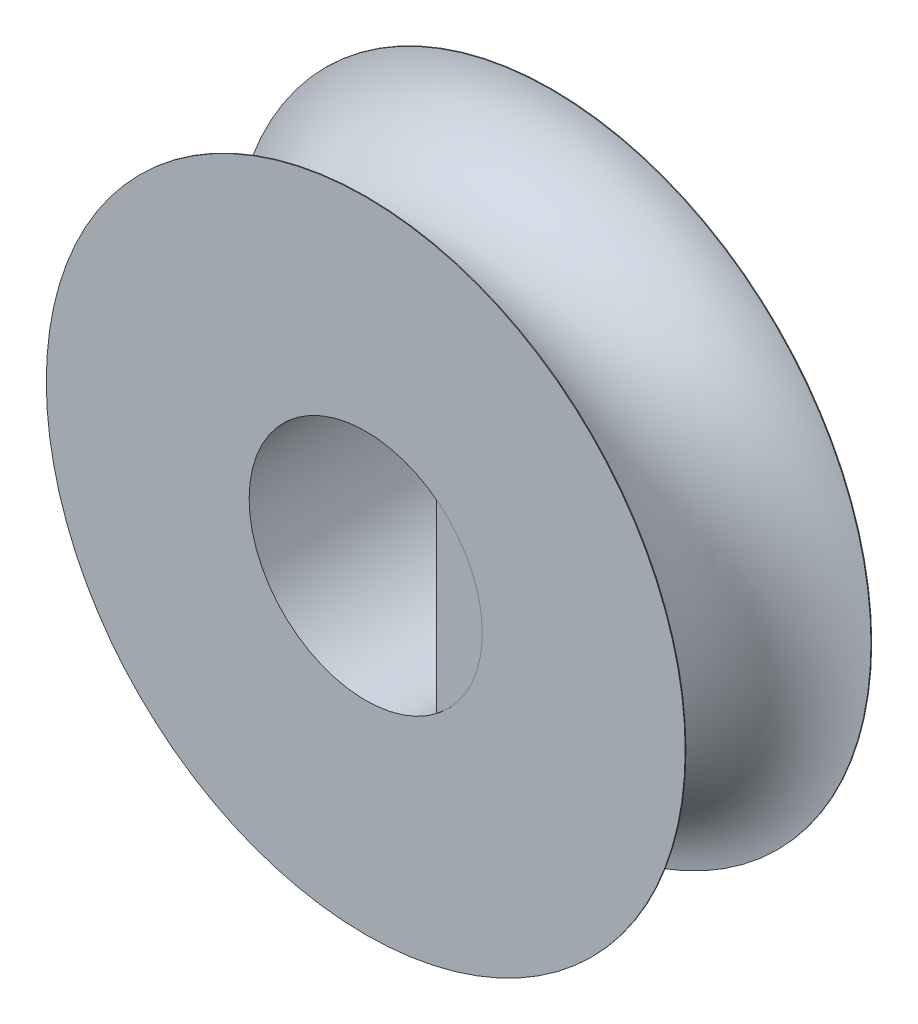
from build123d import *

# Parameters (mm, degrees)
SKETCH_1_R          = 13.7
EXTRUDE_1_DEPTH     = 8
SKETCH_4_R          = 5
CUT_EXTRUDE_1_DEPTH = 21.961393083
EXTRUDE_2_REACH     = 25.034
SKETCH_5_W          = 7.968626967
SKETCH_5_H          = 13.552288672


with BuildPart() as part:
    # 스케치1 → 보스-돌출1 (new body)
    with BuildSketch(Plane.XY):
        Circle(SKETCH_1_R)
    extrude(amount=EXTRUDE_1_DEPTH)

    # 스케치2 → 컷-회전1 (revolve, cut)
    with BuildSketch(Plane(origin=(0, 0, 0), x_dir=(1, 0, 0), z_dir=(0, 1, 0)), mode=Mode.PRIVATE) as cut_revolve_1_sk:
        with BuildLine():
            Line((-14.7, 0), (-14.7, -8))
            Line((-14.7, -8), (-14.2, -8))
            ThreePointArc((-14.2, -8), (-10.2, -4), (-14.2, 0))
            Line((-14.2, 0), (-14.7, 0))
        make_face()
    revolve(cut_revolve_1_sk.sketch.rotate(Axis((0, 0, 12.586575048), (0, 0, -1)), 180), axis=Axis((0, 0, 12.586575048), (0, 0, -1)), mode=Mode.SUBTRACT)

    # 스케치4 → 컷-돌출1 (cut, through all)
    with BuildSketch(Plane(origin=(0, 0, 0), x_dir=(-1, 0, 0), z_dir=(0, 0, -1))):
        Circle(SKETCH_4_R)
    extrude(amount=-CUT_EXTRUDE_1_DEPTH, mode=Mode.SUBTRACT)

    # 스케치5 → 보스-돌출2 (add, up to next)
    with BuildSketch(Plane(origin=(3, 0, 0), x_dir=(0, 0, -1), z_dir=(1, 0, 0)), mode=Mode.PRIVATE) as extrude_2_sk1:
        with Locations((-3.984313484, -0.077510512)):
            Rectangle(SKETCH_5_W, SKETCH_5_H)
    extrude_2_tool1 = extrude(extrude_2_sk1.sketch, amount=EXTRUDE_2_REACH, mode=Mode.PRIVATE) - part.part
    add(extrude_2_tool1.solids().sort_by_distance((3, -0.077511, 3.984313))[0])


solid = part.part
